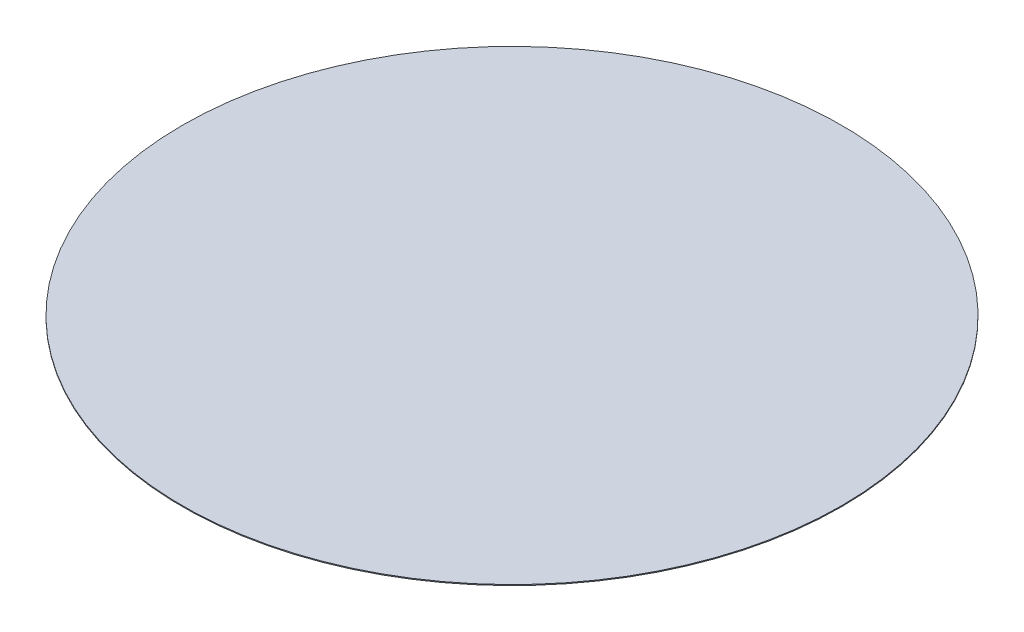
from build123d import *

# Parameters (mm, degrees)
SKETCH1_R           = 360
BOSS_EXTRUDE1_DEPTH = 1


with BuildPart() as part:
    # Sketch1 → Boss-Extrude1 (new body)
    with BuildSketch(Plane.XZ.offset(1360)):
        Circle(SKETCH1_R)
    extrude(amount=BOSS_EXTRUDE1_DEPTH)


solid = part.part
